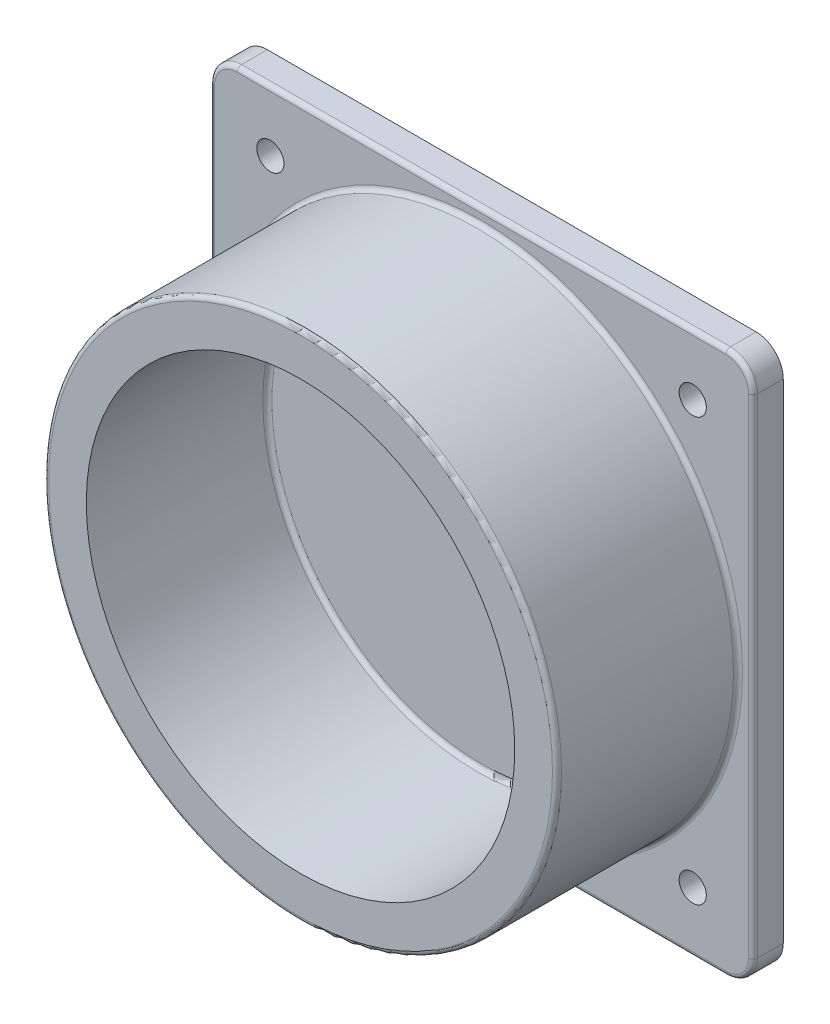
from build123d import *

# Parameters (mm, degrees)
SKETCH1_R           = 9
SKETCH1_R_2         = 4.5
BOSS_EXTRUDE1_DEPTH = 10
SKETCH2_R           = 85
BOSS_EXTRUDE2_DEPTH = 60
SKETCH3_R           = 71
CUT_EXTRUDE1_DEPTH  = 60
FILLET1_R           = 1.5


with BuildPart() as part:
    # Sketch1 → Boss-Extrude1 (new body)
    with BuildSketch(Plane.XY):
        with BuildLine():
            Line((-81, -90), (81, -90))
            ThreePointArc((81, -90), (87.363961031, -87.363961031), (90, -81))
            Line((90, -81), (90, 81))
            ThreePointArc((90, 81), (87.363961031, 87.363961031), (81, 90))
            Line((81, 90), (-81, 90))
            ThreePointArc((-81, 90), (-87.363961031, 87.363961031), (-90, 81))
            Line((-90, 81), (-90, -81))
            ThreePointArc((-90, -81), (-87.363961031, -87.363961031), (-81, -90))
        make_face()
        Circle(SKETCH1_R, mode=Mode.SUBTRACT)
        with Locations((70, 70)):
            Circle(SKETCH1_R_2, mode=Mode.SUBTRACT)
        with Locations(Location((-70, 70, 0), (0, 0, 180))):
            Circle(SKETCH1_R_2, mode=Mode.SUBTRACT)
        with Locations(Location((70, -70, 0), (0, 0, 180))):
            Circle(SKETCH1_R_2, mode=Mode.SUBTRACT)
        with Locations((-70, -70)):
            Circle(SKETCH1_R_2, mode=Mode.SUBTRACT)
    extrude(amount=BOSS_EXTRUDE1_DEPTH)

    # Sketch2 → Boss-Extrude2 (add)
    with BuildSketch(Plane.XY.offset(10)):
        with Locations(Location((0, 0, 0), (0, 0, 180))):
            Circle(SKETCH2_R)
    extrude(amount=BOSS_EXTRUDE2_DEPTH)

    # Sketch3 → Cut-Extrude1 (cut)
    with BuildSketch(Plane.XY.offset(70)):
        Circle(SKETCH3_R)
    extrude(amount=-CUT_EXTRUDE1_DEPTH, mode=Mode.SUBTRACT)

    # Fillet1
    fillet1_edges = [part.edges().sort_by_distance(p)[0] for p in [
        (87.363961031, 87.363961031, 10),
        (0, 90, 10),
        (-87.363961031, 87.363961031, 10),
        (-90, 0, 10),
        (-87.363961031, -87.363961031, 10),
        (0, -90, 10),
        (87.363961031, -87.363961031, 10),
        (85, 0, 10),
        (85, 0, 70),
        (-71, 0, 10),
        (90, 0, 10),
    ]]
    fillet(fillet1_edges, radius=FILLET1_R)


solid = part.part
